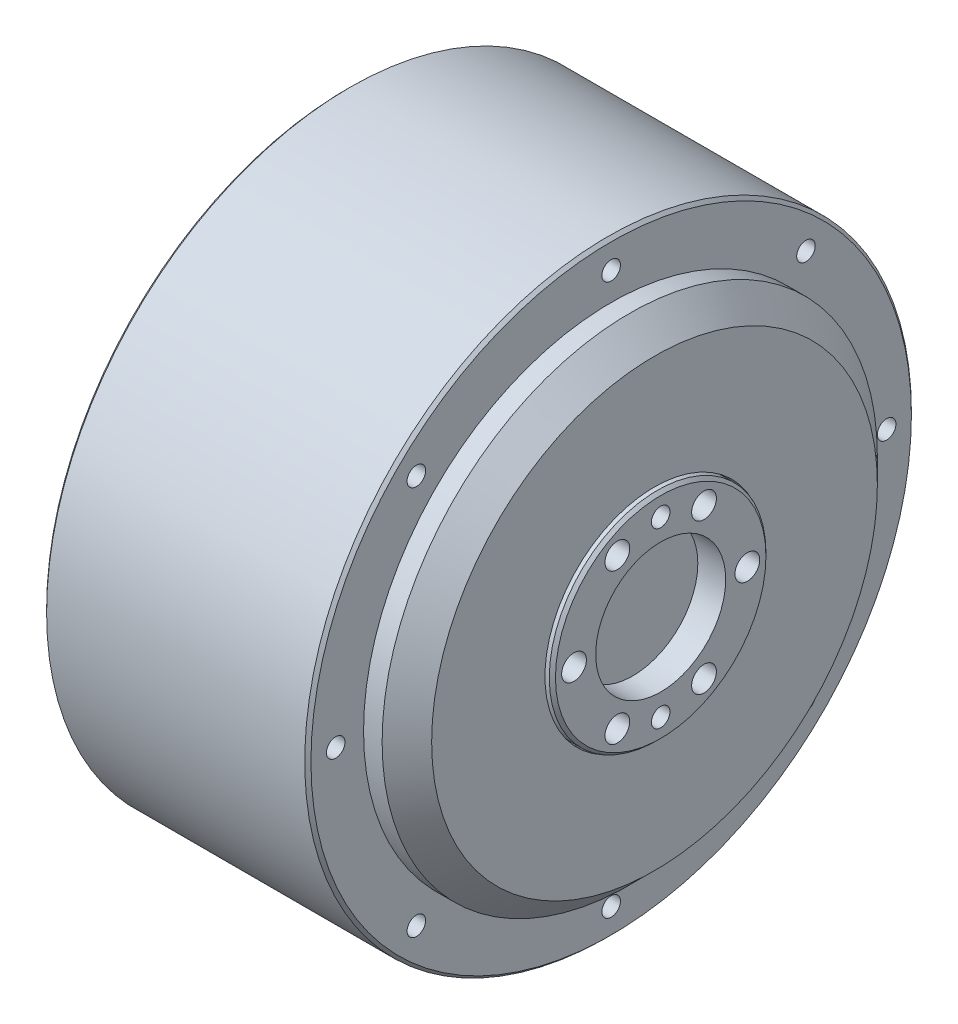
from build123d import *

# Parameters (mm, degrees)
SKETCH1_W                         = 42.7
SKETCH1_H                         = 49
SKETCH2_R                         = 35.5
BOSS_EXTRUDE1_DEPTH               = 11.2
CUT_EXTRUDE1_START                = -8
CUT_EXTRUDE1_DEPTH                = 8
SKETCH4_R                         = 40
BOSS_EXTRUDE2_DEPTH               = 3
SKETCH5_R                         = 40
BOSS_EXTRUDE3_DEPTH               = 4
BOSS_EXTRUDE3_TAPER               = 45.000000001
M33_CLEARANCE_HOLE1_D             = 35.4
M33_CLEARANCE_HOLE1_DEPTH         = 7.5
SKETCH8_W                         = 8.5
SKETCH8_H                         = 17.5
F_3_0_3_DIAMETER_HOLE1_D          = 3
F_3_0_3_DIAMETER_HOLE1_DEPTH      = 4
F_3_0_3_DIAMETER_HOLE2_D          = 3
F_3_0_3_DIAMETER_HOLE2_DEPTH      = 8
F_21_0_21_DIAMETER_HOLE1_D        = 21
F_21_0_21_DIAMETER_HOLE1_DEPTH    = 4.5
F_4_0_4_DIAMETER_HOLE1_D          = 4
F_4_0_4_DIAMETER_HOLE1_DEPTH      = 8
F_3_0_3_DIAMETER_HOLE3_D          = 3
F_3_0_3_DIAMETER_HOLE3_DEPTH      = 3
CHAMFER1_SIZE                     = 0.5
SKETCH19_R                        = 38.44010433
CUT_EXTRUDE2_DEPTH                = 10.2
CUT_EXTRUDE3_START                = -1
SKETCH20_R                        = 38.36803995
SKETCH20_R_2                      = 35.5
SKETCH20_R_3                      = 34
SKETCH20_R_4                      = 32.5
CUT_EXTRUDE3_DEPTH                = 1
TAP_DRILL_FOR_M3_TAP2_D           = 2.5
TAP_DRILL_FOR_M3_TAP2_DEPTH       = 2
TAP_DRILL_FOR_M3_TAP2_CSINK_D     = 2.55
TAP_DRILL_FOR_M3_TAP2_CSINK_ANGLE = 90
TAP_DRILL_FOR_M3_TAP2_TIP         = 0.751075774
SKETCH24_R                        = 2.55
SKETCH24_R_2                      = 1.25
BOSS_EXTRUDE4_DEPTH               = 3


with BuildPart() as part:
    # Sketch1 → Revolve1 (revolve)
    with BuildSketch(Plane.XY, mode=Mode.PRIVATE) as revolve1_sk:
        with Locations((-29.35, 24.5)):
            Rectangle(SKETCH1_W, SKETCH1_H)
    revolve(revolve1_sk.sketch.rotate(Axis((-50.7, 0, 0), (1, 0, 0)), 270), axis=Axis((-50.7, 0, 0), (1, 0, 0)))

    # Sketch2 → Boss-Extrude1 (add)
    with BuildSketch(Plane.ZY.offset(50.7)):
        Circle(SKETCH2_R)
    extrude(amount=BOSS_EXTRUDE1_DEPTH)

    # Sketch3 → Cut-Extrude1 (cut)
    with BuildSketch(Plane.ZY.offset(61.9).offset(CUT_EXTRUDE1_START)):
        with BuildLine():
            Line((5.253044864, 35.109194233), (32.553289394, 14.160979826))
            ThreePointArc((32.553289394, 14.160979826), (21.61103073, 28.16404358), (5.253044864, 35.109194233))
        make_face()
    extrude(amount=CUT_EXTRUDE1_DEPTH, mode=Mode.SUBTRACT)

    # Sketch4 → Boss-Extrude2 (add)
    with BuildSketch(Plane(origin=(-8, 0, 0), x_dir=(0, 0, -1), z_dir=(1, 0, 0))):
        Circle(SKETCH4_R)
    extrude(amount=BOSS_EXTRUDE2_DEPTH)

    # Sketch5 → Boss-Extrude3 (add)
    with BuildSketch(Plane(origin=(-5, 0, 0), x_dir=(0, 0, -1), z_dir=(1, 0, 0))):
        Circle(SKETCH5_R)
    extrude(amount=BOSS_EXTRUDE3_DEPTH, taper=BOSS_EXTRUDE3_TAPER)

    # M33 Clearance Hole1
    with Locations(Plane(origin=(-1, 0, 0), x_dir=(0, 0, -1), z_dir=(1, 0, 0))):
        with Locations((0, 0)):
            Hole(M33_CLEARANCE_HOLE1_D / 2, depth=M33_CLEARANCE_HOLE1_DEPTH)

    # Sketch8 → Revolve2 (revolve)
    with BuildSketch(Plane.XY, mode=Mode.PRIVATE) as revolve2_sk:
        with Locations((-4.25, 8.75)):
            Rectangle(SKETCH8_W, SKETCH8_H)
    revolve(revolve2_sk.sketch.rotate(Axis((-8.5, 0, 0), (1, 0, 0)), 270), axis=Axis((-8.5, 0, 0), (1, 0, 0)))

    # Ø3.0 (3) Diameter Hole1
    with Locations(Plane.ZY.offset(50.7)):
        with Locations((39.264880132, 16.264045876), (39.264880132, -16.264045876), (16.264045876, -39.264880132), (-16.264045876, -39.264880132), (-39.264880132, -16.264045876), (-39.264880132, 16.264045876), (-16.264045876, 39.264880132), (16.264045876, 39.264880132)):
            Hole(F_3_0_3_DIAMETER_HOLE1_D / 2, depth=F_3_0_3_DIAMETER_HOLE1_DEPTH)

    # Ø3.0 (3) Diameter Hole2
    with Locations(Plane(origin=(-8, 0, 0), x_dir=(0, 0, -1), z_dir=(1, 0, 0))):
        with Locations((31.466251763, 31.466251763), (44.5, 0), (31.466251763, -31.466251763), (0, -44.5), (-31.466251763, -31.466251763), (-44.5, 0), (-31.466251763, 31.466251763), (0, 44.5)):
            Hole(F_3_0_3_DIAMETER_HOLE2_D / 2, depth=F_3_0_3_DIAMETER_HOLE2_DEPTH)

    # Ø21.0 (21) Diameter Hole1
    with Locations(Plane(origin=(0, 0, 0), x_dir=(0, 0, -1), z_dir=(1, 0, 0))):
        with Locations((0, 0)):
            Hole(F_21_0_21_DIAMETER_HOLE1_D / 2, depth=F_21_0_21_DIAMETER_HOLE1_DEPTH)

    # Ø4.0 (4) Diameter Hole1
    with Locations(Plane(origin=(0, 0, 0), x_dir=(0, 0, -1), z_dir=(1, 0, 0))):
        with Locations((-14, 0), (-7, 12.124355653), (7, 12.124355653), (14, 0), (7, -12.124355653), (-7, -12.124355653)):
            Hole(F_4_0_4_DIAMETER_HOLE1_D / 2, depth=F_4_0_4_DIAMETER_HOLE1_DEPTH)

    # Ø3.0 (3) Diameter Hole3
    with Locations(Plane(origin=(0, 0, 0), x_dir=(0, 0, -1), z_dir=(1, 0, 0))):
        with Locations((0, -14), (0, 14)):
            Hole(F_3_0_3_DIAMETER_HOLE3_D / 2, depth=F_3_0_3_DIAMETER_HOLE3_DEPTH)

    # Chamfer1
    chamfer1_edges = [part.edges().sort_by_distance(p)[0] for p in [
        (0, 0, 17.5),
        (-8, 0, 49),
        (-50.7, 0, 49),
    ]]
    chamfer(chamfer1_edges, length=CHAMFER1_SIZE)

    # Sketch19 → Cut-Extrude2 (cut)
    with BuildSketch(Plane.ZY.offset(61.9)):
        Circle(SKETCH19_R)
    extrude(amount=-CUT_EXTRUDE2_DEPTH, mode=Mode.SUBTRACT)

    # Sketch20 → Cut-Extrude3 (cut)
    # profile 1 of 3: a face of its own
    with BuildSketch(Plane.ZY.offset(51.7).offset(CUT_EXTRUDE3_START)):
        Circle(SKETCH20_R)
        Circle(SKETCH20_R_2, mode=Mode.SUBTRACT)
    # profile 2 of 3: a face of its own
    with BuildSketch(Plane.ZY.offset(51.7).offset(CUT_EXTRUDE3_START)):
        Circle(SKETCH20_R_2)
        Circle(SKETCH20_R_3, mode=Mode.SUBTRACT)
    # profile 3 of 3: a face of its own
    with BuildSketch(Plane.ZY.offset(51.7).offset(CUT_EXTRUDE3_START)):
        Circle(SKETCH20_R_4)
    extrude(amount=CUT_EXTRUDE3_DEPTH, mode=Mode.SUBTRACT)

    # Tap Drill for M3 Tap2
    with Locations(Plane.ZY.offset(50.7)):
        with Locations((-16.740939298, -21.817216858), (-10.52379439, 25.406687144), (27.264733688, -3.589470286)):
            CounterSinkHole(TAP_DRILL_FOR_M3_TAP2_D / 2, TAP_DRILL_FOR_M3_TAP2_CSINK_D / 2, depth=TAP_DRILL_FOR_M3_TAP2_DEPTH, counter_sink_angle=TAP_DRILL_FOR_M3_TAP2_CSINK_ANGLE)
            with Locations((0, 0, -(TAP_DRILL_FOR_M3_TAP2_DEPTH + TAP_DRILL_FOR_M3_TAP2_TIP / 2))):  # 118° drill point
                Cone(0, TAP_DRILL_FOR_M3_TAP2_D / 2, TAP_DRILL_FOR_M3_TAP2_TIP, mode=Mode.SUBTRACT)

    # Sketch24 → Boss-Extrude4 (add)
    # profile 1 of 3: a face of its own
    with BuildSketch(Plane.ZY.offset(50.7)):
        with Locations((-10.52379439, 25.406687144)):
            Circle(SKETCH24_R)
        with Locations((-10.52379439, 25.406687144)):
            Circle(SKETCH24_R_2, mode=Mode.SUBTRACT)
    # profile 2 of 3: a face of its own
    with BuildSketch(Plane.ZY.offset(50.7)):
        with Locations((-16.740939298, -21.817216858)):
            Circle(SKETCH24_R)
        with Locations((-16.740939298, -21.817216858)):
            Circle(SKETCH24_R_2, mode=Mode.SUBTRACT)
    # profile 3 of 3: a face of its own
    with BuildSketch(Plane.ZY.offset(50.7)):
        with Locations((27.264733688, -3.589470286)):
            Circle(SKETCH24_R)
        with Locations((27.264733688, -3.589470286)):
            Circle(SKETCH24_R_2, mode=Mode.SUBTRACT)
    extrude(amount=BOSS_EXTRUDE4_DEPTH)


solid = part.part
